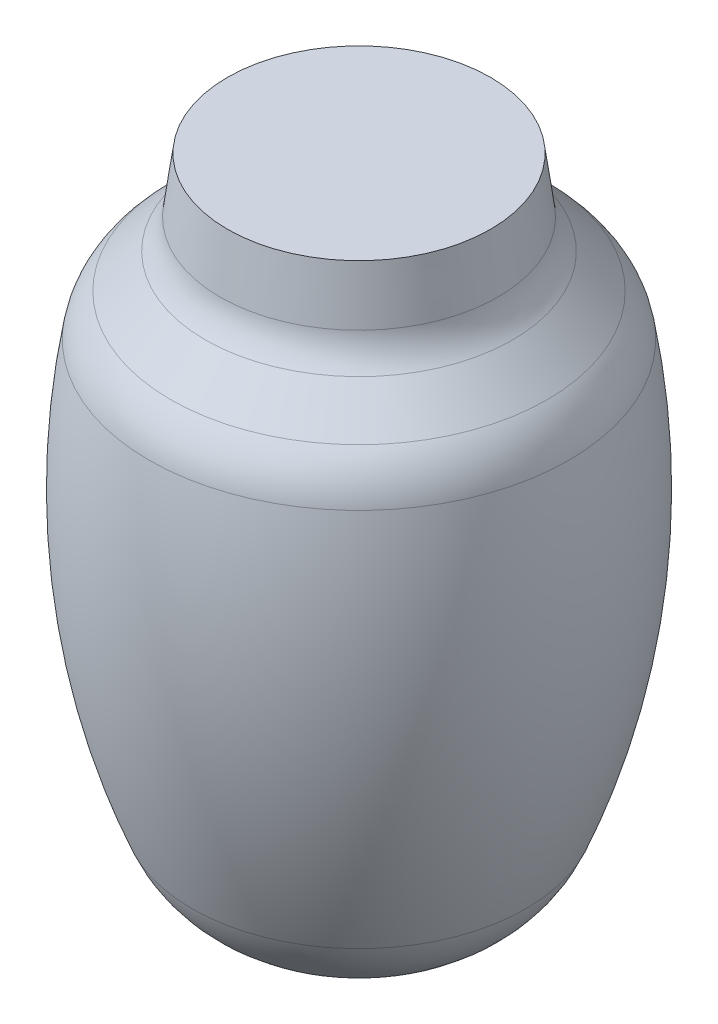
from build123d import *


with BuildPart() as part:
    # Sketch3 → Revolve2 (revolve)
    with BuildSketch(Plane.XY, mode=Mode.PRIVATE) as revolve2_sk:
        with BuildLine():
            Line((527.845824353, 345.220801965), (519.382659671, 353.683966647))
            ThreePointArc((519.382659671, 353.683966647), (516.980270901, 357.031692672), (515.776115024, 360.972346166))
            Line((515.776115024, 360.972346166), (513.96365509, 374.456232673))
            Line((513.96365509, 374.456232673), (481.719516666, 374.456232673))
            Line((481.719516666, 374.456232673), (481.719516666, 214.64452317))
            Line((481.719516666, 214.64452317), (493.161907992, 214.64452317))
            ThreePointArc((493.161907992, 214.64452317), (510.955066032, 220.098781557), (522.6349339, 234.587608086))
            ThreePointArc((522.6349339, 234.587608086), (534.882960602, 284.072522551), (533.142595858, 335.020947926))
            ThreePointArc((533.142595858, 335.020947926), (531.281770341, 340.529853995), (527.845824353, 345.220801965))
        make_face()
    revolve(revolve2_sk.sketch.rotate(Axis((481.719516666, 374.456232673, 0), (0, -1, 0)), 90), axis=Axis((481.719516666, 374.456232673, 0), (0, -1, 0)))


solid = part.part
